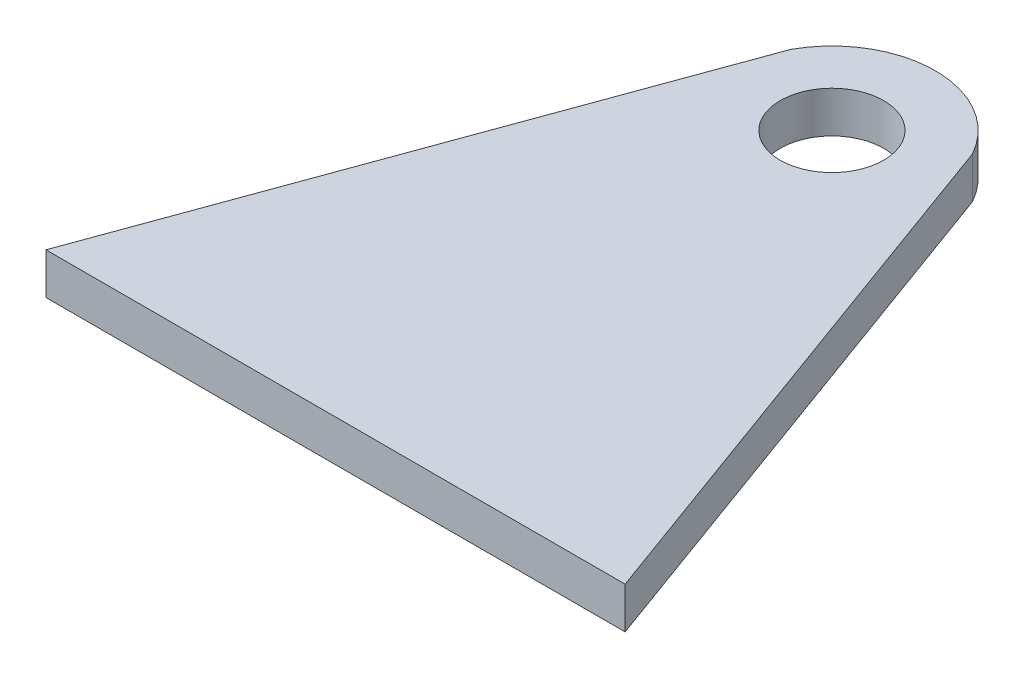
from build123d import *

# Parameters (mm, degrees)
SKETCH9_R           = 25
BOSS_EXTRUDE7_DEPTH = 10


with BuildPart() as part:
    # Sketch9 → Boss-Extrude7 (new, symmetric)
    with BuildSketch(Plane(origin=(0, 0, 0), x_dir=(1, 0, 0), z_dir=(0, 1, 0))):
        with BuildLine():
            Line((0, -240), (140, -240))
            Line((140, -240), (43.894055239, 23.943932732))
            ThreePointArc((43.894055239, 23.943932732), (0, 50), (-43.894055239, 23.943932732))
            Line((-43.894055239, 23.943932732), (-140, -240))
            Line((-140, -240), (0, -240))
        make_face()
        with Locations(Location((0, 0, 0), (0, 0, 270))):
            Circle(SKETCH9_R, mode=Mode.SUBTRACT)
    extrude(amount=BOSS_EXTRUDE7_DEPTH, both=True)


solid = part.part
